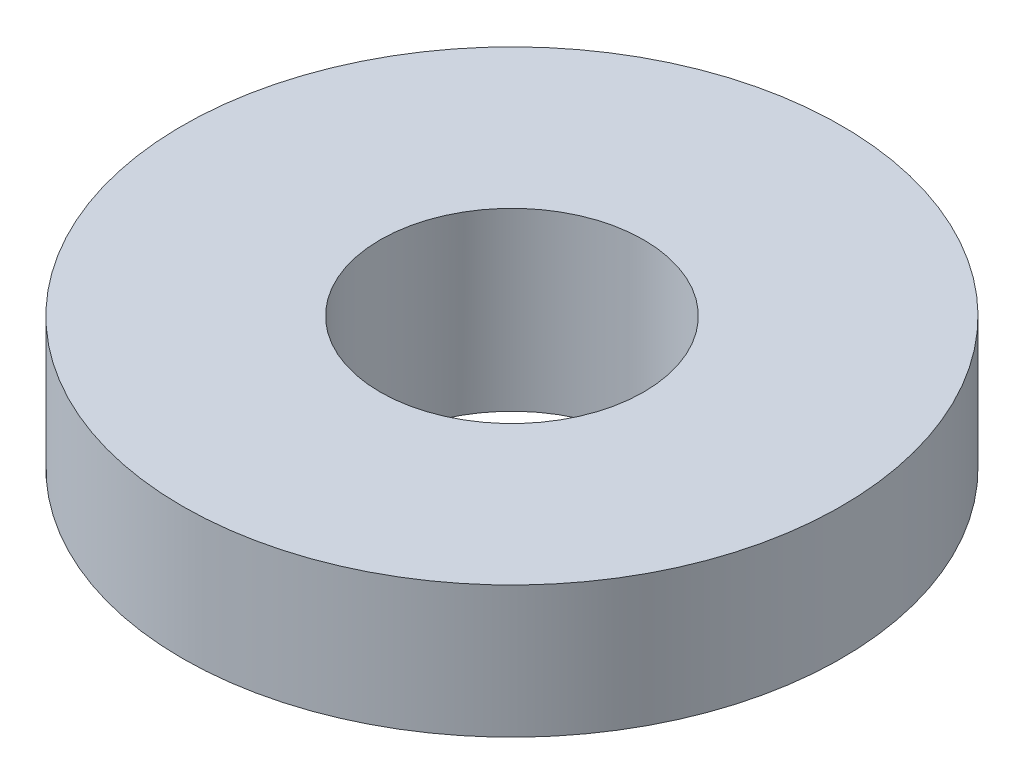
from build123d import *

# Parameters (mm, degrees)
SKETCH1_R           = 3.75
BOSS_EXTRUDE1_DEPTH = 1.5
SKETCH2_R           = 2.5
BOSS_EXTRUDE2_DEPTH = 0.5
SKETCH3_R           = 1.5
CUT_EXTRUDE1_DEPTH  = 2


with BuildPart() as part:
    # Sketch1 → Boss-Extrude1 (new body)
    with BuildSketch(Plane(origin=(0, 0, 0), x_dir=(1, 0, 0), z_dir=(0, 1, 0))):
        with Locations(Location((0, 0, 0), (0, 0, 270))):
            Circle(SKETCH1_R)
    extrude(amount=BOSS_EXTRUDE1_DEPTH)

    # Sketch2 → Boss-Extrude2 (add)
    with BuildSketch(Plane.XZ):
        with Locations(Location((0, 0, 0), (0, 0, 270))):
            Circle(SKETCH2_R)
    extrude(amount=BOSS_EXTRUDE2_DEPTH)

    # Sketch3 → Cut-Extrude1 (cut)
    with BuildSketch(Plane.XZ.offset(0.5)):
        with Locations(Location((0, 0, 0), (0, 0, 270))):
            Circle(SKETCH3_R)
    extrude(amount=-CUT_EXTRUDE1_DEPTH, mode=Mode.SUBTRACT)


solid = part.part
